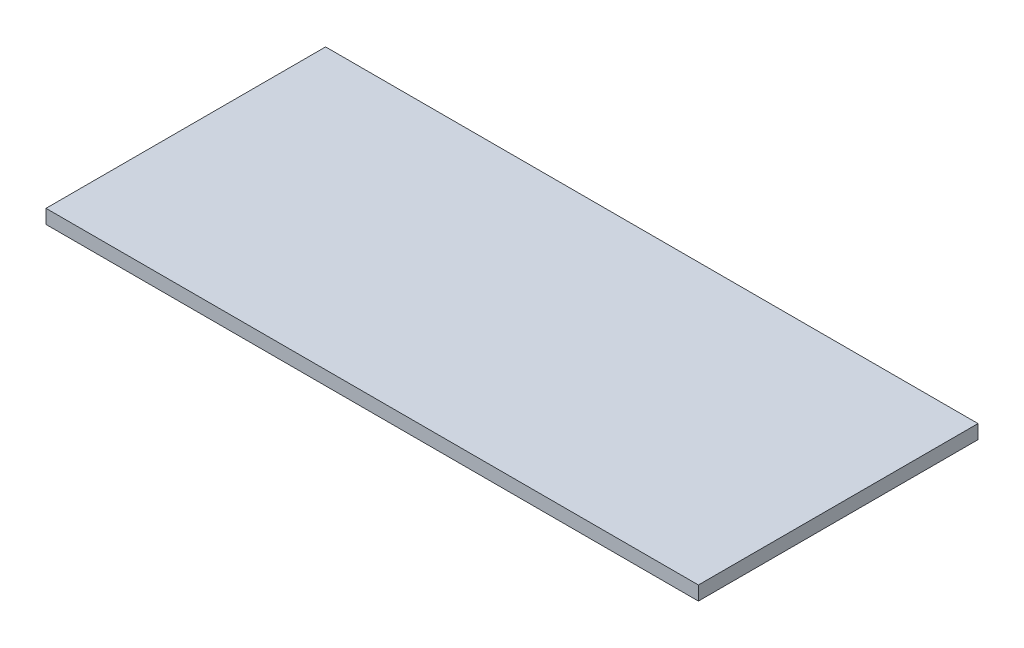
from build123d import *

# Parameters (mm, degrees)
CROQUIS1_W              = 700
CROQUIS1_H              = 300
SALIENTE_EXTRUIR1_DEPTH = 15


with BuildPart() as part:
    # Croquis1 → Saliente-Extruir1 (new body)
    with BuildSketch(Plane(origin=(0, 0, 0), x_dir=(1, 0, 0), z_dir=(0, 1, 0))):
        Rectangle(CROQUIS1_W, CROQUIS1_H)
    extrude(amount=SALIENTE_EXTRUIR1_DEPTH)


solid = part.part
